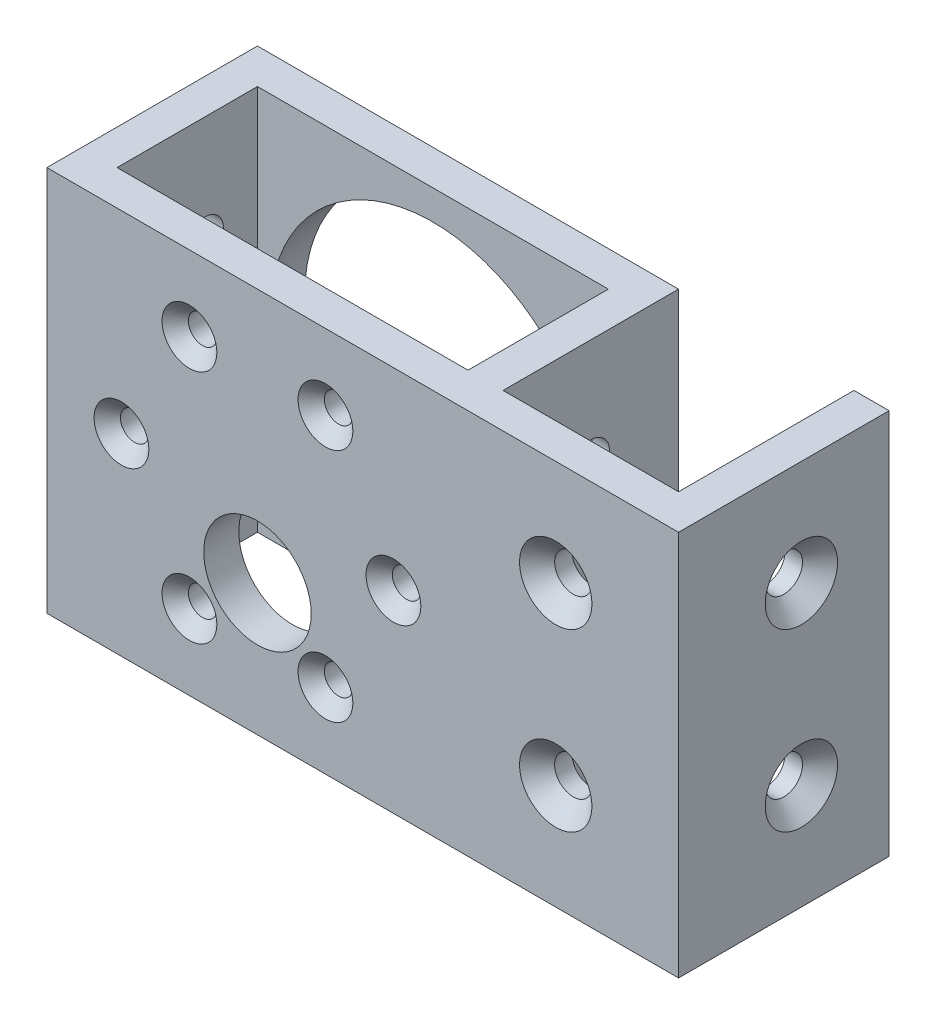
from build123d import *

# Parameters (mm, degrees)
SKETCH1_W           = 40
SKETCH1_H           = 16
BOSS_EXTRUDE1_DEPTH = 44
CUT_EXTRUDE1_REACH  = 86.475
SKETCH2_R           = 18.625
CUT_EXTRUDE2_REACH  = 86.475
SKETCH3_R           = 6.125
SKETCH3_R_2         = 1.625
SKETCH4_R           = 2.125
CUT_EXTRUDE3_DEPTH  = 87.717933555
SKETCH5_R           = 2.125
CUT_EXTRUDE4_DEPTH  = 85.474848328
CHAMFER1_SIZE       = 2
CHAMFER2_SIZE       = 1.5


with BuildPart() as part:
    # Sketch1 → Boss-Extrude1 (new body)
    with BuildSketch(Plane(origin=(0, 0, 0), x_dir=(1, 0, 0), z_dir=(0, 1, 0))):
        Polygon((4, 20), (0, 20), (0, 0), (-20, 0), (-20, 20), (-24, 20), (-68, 20), (-68, 16), (-68, 0), (-68, -4), (-24, -4), (4, -4), align=None)
        with Locations((-44, 8)):
            Rectangle(SKETCH1_W, SKETCH1_H, mode=Mode.SUBTRACT)
    extrude(amount=BOSS_EXTRUDE1_DEPTH)

    # Sketch2 → Cut-Extrude1 (cut, up to next)
    with BuildSketch(Plane(origin=(0, 0, -20), x_dir=(-1, 0, 0), z_dir=(0, 0, -1)), mode=Mode.PRIVATE) as cut_extrude1_sk1:
        with Locations((44, 22)):
            Circle(SKETCH2_R)
    cut_extrude1_tool1 = extrude(cut_extrude1_sk1.sketch, amount=-CUT_EXTRUDE1_REACH, mode=Mode.PRIVATE) & part.part
    add(cut_extrude1_tool1.solids().sort_by_distance((-44, 22, -20))[0], mode=Mode.SUBTRACT)

    # Sketch3 → Cut-Extrude2 (cut, up to next)
    with BuildSketch(Plane.XY.offset(4), mode=Mode.PRIVATE) as cut_extrude2_sk1:
        with Locations((-44, 15)):
            Circle(SKETCH3_R)
    cut_extrude2_tool1 = extrude(cut_extrude2_sk1.sketch, amount=-CUT_EXTRUDE2_REACH, mode=Mode.PRIVATE) & part.part
    # Sketch3 → Cut-Extrude2 (cut, up to next)
    with BuildSketch(Plane.XY.offset(4), mode=Mode.PRIVATE) as cut_extrude2_sk2:
        with Locations((-51.75, 35.423393759)):
            Circle(SKETCH3_R_2)
    cut_extrude2_tool2 = extrude(cut_extrude2_sk2.sketch, amount=-CUT_EXTRUDE2_REACH, mode=Mode.PRIVATE) & part.part
    # Sketch3 → Cut-Extrude2 (cut, up to next)
    with BuildSketch(Plane.XY.offset(4), mode=Mode.PRIVATE) as cut_extrude2_sk3:
        with Locations((-36.25, 35.423393759)):
            Circle(SKETCH3_R_2)
    cut_extrude2_tool3 = extrude(cut_extrude2_sk3.sketch, amount=-CUT_EXTRUDE2_REACH, mode=Mode.PRIVATE) & part.part
    # Sketch3 → Cut-Extrude2 (cut, up to next)
    with BuildSketch(Plane.XY.offset(4), mode=Mode.PRIVATE) as cut_extrude2_sk4:
        with Locations((-28.5, 22)):
            Circle(SKETCH3_R_2)
    cut_extrude2_tool4 = extrude(cut_extrude2_sk4.sketch, amount=-CUT_EXTRUDE2_REACH, mode=Mode.PRIVATE) & part.part
    # Sketch3 → Cut-Extrude2 (cut, up to next)
    with BuildSketch(Plane.XY.offset(4), mode=Mode.PRIVATE) as cut_extrude2_sk5:
        with Locations((-36.25, 8.576606241)):
            Circle(SKETCH3_R_2)
    cut_extrude2_tool5 = extrude(cut_extrude2_sk5.sketch, amount=-CUT_EXTRUDE2_REACH, mode=Mode.PRIVATE) & part.part
    # Sketch3 → Cut-Extrude2 (cut, up to next)
    with BuildSketch(Plane.XY.offset(4), mode=Mode.PRIVATE) as cut_extrude2_sk6:
        with Locations((-51.75, 8.576606241)):
            Circle(SKETCH3_R_2)
    cut_extrude2_tool6 = extrude(cut_extrude2_sk6.sketch, amount=-CUT_EXTRUDE2_REACH, mode=Mode.PRIVATE) & part.part
    # Sketch3 → Cut-Extrude2 (cut, up to next)
    with BuildSketch(Plane.XY.offset(4), mode=Mode.PRIVATE) as cut_extrude2_sk7:
        with Locations((-59.5, 22)):
            Circle(SKETCH3_R_2)
    cut_extrude2_tool7 = extrude(cut_extrude2_sk7.sketch, amount=-CUT_EXTRUDE2_REACH, mode=Mode.PRIVATE) & part.part
    add(cut_extrude2_tool1.solids().sort_by_distance((-44, 15, 4))[0], mode=Mode.SUBTRACT)
    add(cut_extrude2_tool2.solids().sort_by_distance((-51.75, 35.423394, 4))[0], mode=Mode.SUBTRACT)
    add(cut_extrude2_tool3.solids().sort_by_distance((-36.25, 35.423394, 4))[0], mode=Mode.SUBTRACT)
    add(cut_extrude2_tool4.solids().sort_by_distance((-28.5, 22, 4))[0], mode=Mode.SUBTRACT)
    add(cut_extrude2_tool5.solids().sort_by_distance((-36.25, 8.576606, 4))[0], mode=Mode.SUBTRACT)
    add(cut_extrude2_tool6.solids().sort_by_distance((-51.75, 8.576606, 4))[0], mode=Mode.SUBTRACT)
    add(cut_extrude2_tool7.solids().sort_by_distance((-59.5, 22, 4))[0], mode=Mode.SUBTRACT)

    # Sketch4 → Cut-Extrude3 (cut, through all)
    with BuildSketch(Plane(origin=(4, 0, 0), x_dir=(0, 0, -1), z_dir=(1, 0, 0))):
        with Locations((10, 32)):
            Circle(SKETCH4_R)
        with Locations((10, 12)):
            Circle(SKETCH4_R)
    extrude(amount=-CUT_EXTRUDE3_DEPTH, mode=Mode.SUBTRACT)

    # Sketch5 → Cut-Extrude4 (cut, through all)
    with BuildSketch(Plane.XY.offset(4)):
        with Locations((-10, 32)):
            Circle(SKETCH5_R)
        with Locations((-10, 12)):
            Circle(SKETCH5_R)
    extrude(amount=-CUT_EXTRUDE4_DEPTH, mode=Mode.SUBTRACT)

    # Chamfer1
    chamfer1_edges = [part.edges().sort_by_distance(p)[0] for p in [
        (-12.125, 32, 4),
        (-12.125, 12, 4),
        (-24, 32, -7.875),
        (4, 32, -7.875),
        (-24, 12, -7.875),
        (4, 12, -7.875),
    ]]
    chamfer(chamfer1_edges, length=CHAMFER1_SIZE)

    # Chamfer2
    chamfer2_edges = [part.edges().sort_by_distance(p)[0] for p in [
        (-53.375, 35.423393759, 4),
        (-37.875, 35.423393759, 4),
        (-30.125, 22, 4),
        (-37.875, 8.576606241, 4),
        (-53.375, 8.576606241, 4),
        (-61.125, 22, 4),
    ]]
    chamfer(chamfer2_edges, length=CHAMFER2_SIZE)


solid = part.part
